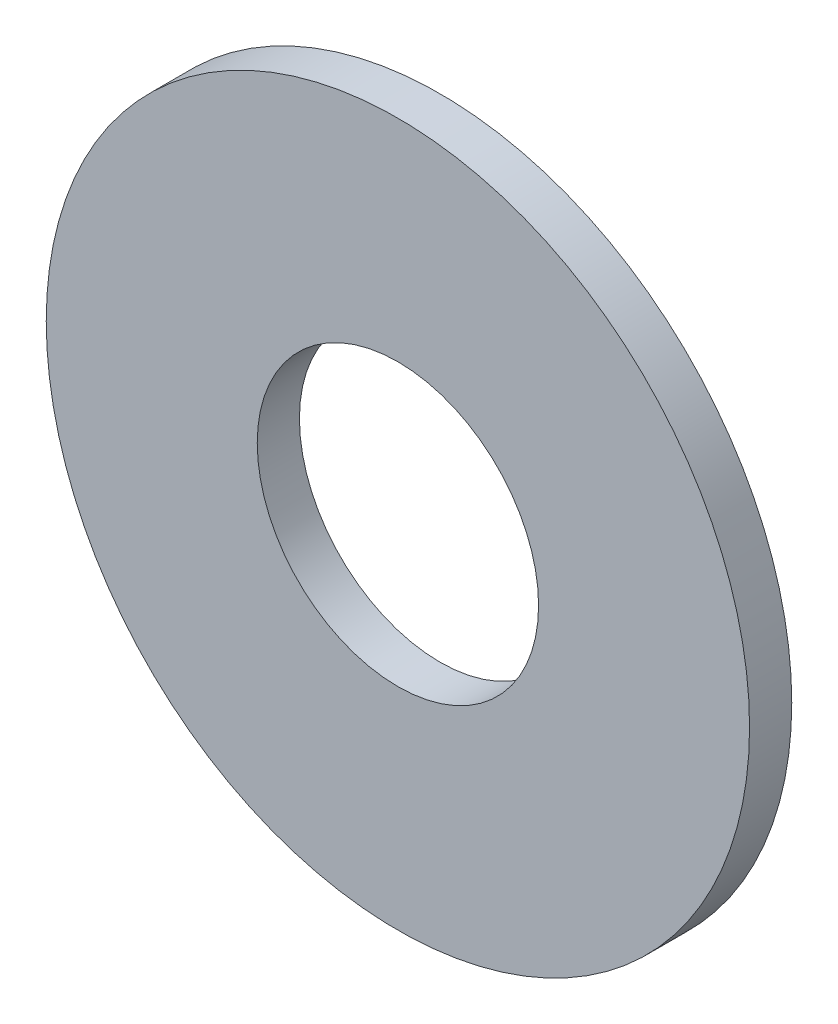
from build123d import *

# Parameters (mm, degrees)
SKETCH1_R           = 2.5
SKETCH1_R_2         = 1
BOSS_EXTRUDE1_DEPTH = 0.3


with BuildPart() as part:
    # Sketch1 → Boss-Extrude1 (new body)
    with BuildSketch(Plane.XY):
        Circle(SKETCH1_R)
        Circle(SKETCH1_R_2, mode=Mode.SUBTRACT)
    extrude(amount=-BOSS_EXTRUDE1_DEPTH)


solid = part.part
